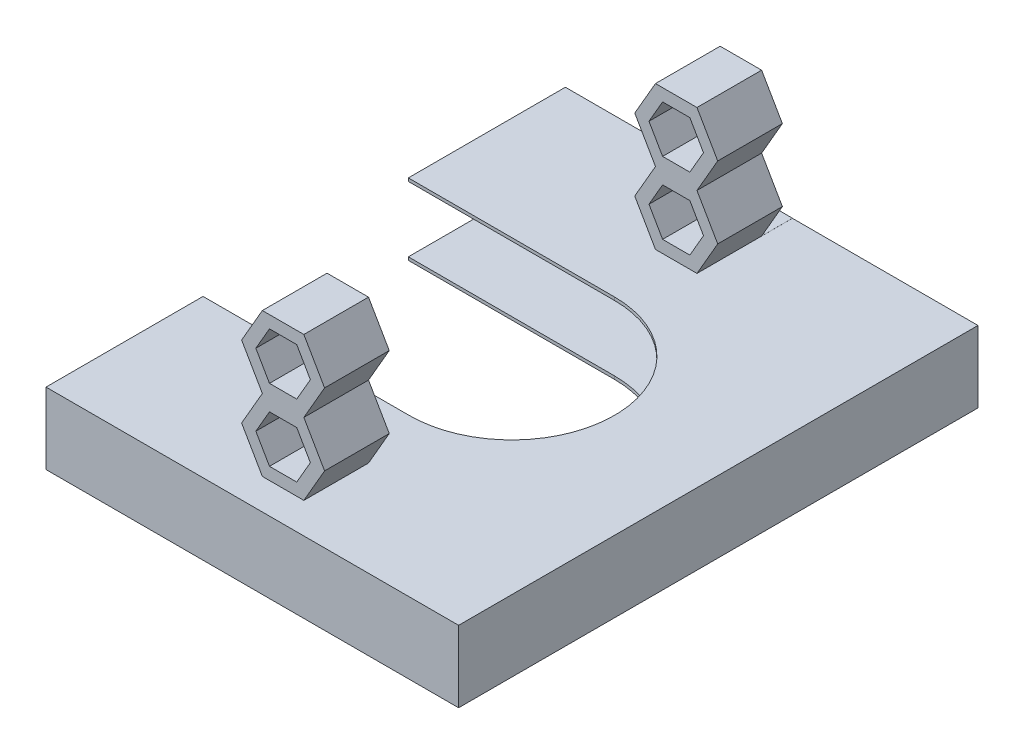
from build123d import *

# Parameters (mm, degrees)
BOSS_EXTRUDE1_DEPTH = 25.3
CUT_EXTRUDE1_DEPTH  = 25.3
SKETCH14_W          = 4.475703298
SKETCH14_H          = 7.178850836
CUT_EXTRUDE6_DEPTH  = 1.5
SKETCH15_W          = 4.041452
SKETCH15_H          = 7.107257799
CUT_EXTRUDE7_DEPTH  = 1.5
SKETCH16_W          = 5.309940562
SKETCH16_H          = 16
CUT_EXTRUDE8_DEPTH  = 7
SKETCH17_W          = 25.3
SKETCH17_H          = 2.501305671
BOSS_EXTRUDE2_DEPTH = 8.029274
SKETCH18_W          = 25.3
SKETCH18_H          = 2.501305671
BOSS_EXTRUDE3_DEPTH = 8.029274
SKETCH20_W          = 20.1
SKETCH20_H          = 25.3
BOSS_EXTRUDE4_DEPTH = 0.978694
CUT_EXTRUDE9_DEPTH  = 3.48
SKETCH22_W          = 25
SKETCH22_H          = 3.18
CUT_EXTRUDE10_DEPTH = 19.8


with BuildPart() as part:
    # Sketch2 → Boss-Extrude1 (new body)
    with BuildSketch(Plane.XY):
        Polygon((3.031088942, 2.501305671), (4.041452, 2.501305671), (4.041452, 0), (0, 0), (0, 2.501305671), (1.010363, 2.501305671), (2.9e-08, 4.251305671), (1.010363, 6.001305671), (2.9e-08, 7.751305671), (1.010363, 9.501305671), (3.031088942, 9.501305671), (4.041451913, 7.751305671), (3.031088942, 6.001305671), (4.041451913, 4.251305671), align=None)
    extrude(amount=BOSS_EXTRUDE1_DEPTH)

    # Sketch3 → Cut-Extrude1 (cut)
    with BuildSketch(Plane.XY.offset(25.3)):
        Polygon((3.34863159, 7.751305671), (2.684678781, 8.901305671), (1.356773162, 8.901305671), (0.692820352, 7.751305671), (1.356773162, 6.601305671), (2.684678781, 6.601305671), align=None)
        Polygon((3.34863159, 4.251305671), (2.684678781, 5.401305671), (1.356773162, 5.401305671), (0.692820352, 4.251305671), (1.356773162, 3.101305671), (2.684678781, 3.101305671), align=None)
    extrude(amount=-CUT_EXTRUDE1_DEPTH, mode=Mode.SUBTRACT)

    # Sketch14 → Cut-Extrude6 (cut)
    with BuildSketch(Plane(origin=(0, 0, 0), x_dir=(-1, 0, 0), z_dir=(0, 0, -1))):
        with Locations((-1.998569053, 6.096687367)):
            Rectangle(SKETCH14_W, SKETCH14_H)
    extrude(amount=-CUT_EXTRUDE6_DEPTH, mode=Mode.SUBTRACT)

    # Sketch15 → Cut-Extrude7 (cut)
    with BuildSketch(Plane.XY.offset(25.3)):
        with Locations((2.020726, 6.054934571)):
            Rectangle(SKETCH15_W, SKETCH15_H)
    extrude(amount=-CUT_EXTRUDE7_DEPTH, mode=Mode.SUBTRACT)

    # Sketch16 → Cut-Extrude8 (cut)
    with BuildSketch(Plane(origin=(0, 9.501305671, 0), x_dir=(1, 0, 0), z_dir=(0, 1, 0))):
        with Locations((1.902727321, -12.65)):
            Rectangle(SKETCH16_W, SKETCH16_H)
    extrude(amount=-CUT_EXTRUDE8_DEPTH, mode=Mode.SUBTRACT)

    # Sketch17 → Boss-Extrude2 (add)
    with BuildSketch(Plane(origin=(4.041452, 0, 0), x_dir=(0, 0, -1), z_dir=(1, 0, 0))):
        with Locations((-12.65, 1.250652836)):
            Rectangle(SKETCH17_W, SKETCH17_H)
    extrude(amount=BOSS_EXTRUDE2_DEPTH)

    # Sketch18 → Boss-Extrude3 (add)
    with BuildSketch(Plane.ZY):
        with Locations((12.65, 1.250652836)):
            Rectangle(SKETCH18_W, SKETCH18_H)
    extrude(amount=BOSS_EXTRUDE3_DEPTH)

    # Sketch20 → Boss-Extrude4 (add)
    with BuildSketch(Plane.XZ):
        with Locations((2.020726, 12.65)):
            Rectangle(SKETCH20_W, SKETCH20_H)
    extrude(amount=BOSS_EXTRUDE4_DEPTH)

    # Sketch21 → Cut-Extrude9 (cut)
    with BuildSketch(Plane(origin=(0, 2.501305671, 0), x_dir=(1, 0, 0), z_dir=(0, 1, 0))):
        with BuildLine():
            Line((-8.029274, -7.65), (2.010726, -7.65))
            ThreePointArc((2.010726, -7.65), (7.010726, -12.65), (2.010726, -17.65))
            Line((2.010726, -17.65), (-8.029274, -17.65))
            Line((-8.029274, -17.65), (-8.029274, -7.65))
        make_face()
    extrude(amount=-CUT_EXTRUDE9_DEPTH, mode=Mode.SUBTRACT)

    # Sketch22 → Cut-Extrude10 (cut)
    with BuildSketch(Plane.ZY.offset(8.029274)):
        with Locations((12.65, 0.761305671)):
            Rectangle(SKETCH22_W, SKETCH22_H)
    extrude(amount=-CUT_EXTRUDE10_DEPTH, mode=Mode.SUBTRACT)


solid = part.part
